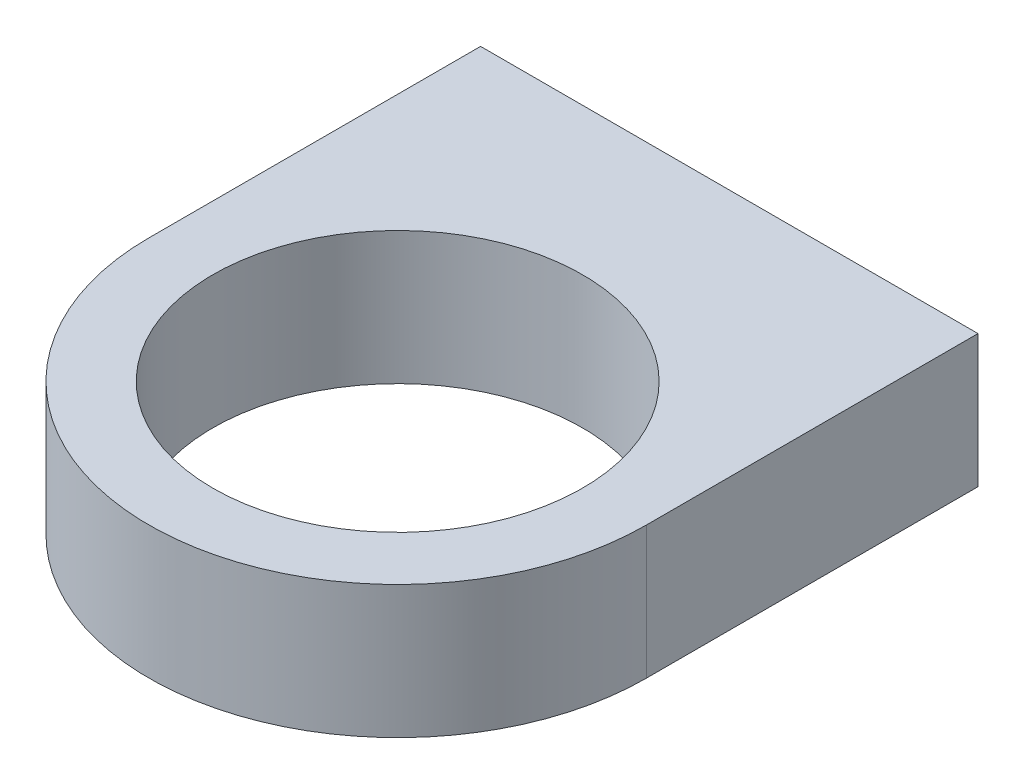
from build123d import *

# Parameters (mm, degrees)
CROQUIS1_R              = 11.15
SALIENTE_EXTRUIR1_DEPTH = 8


with BuildPart() as part:
    # Croquis1 → Saliente-Extruir1 (new body)
    with BuildSketch(Plane(origin=(0, 0, 0), x_dir=(1, 0, 0), z_dir=(0, 1, 0))):
        with BuildLine():
            Line((-15, 0), (-15, 20))
            Line((-15, 20), (15, 20))
            Line((15, 20), (15, 0))
            ThreePointArc((15, 0), (0, -15), (-15, 0))
        make_face()
        with Locations(Location((0, 0, 0), (0, 0, 270))):
            Circle(CROQUIS1_R, mode=Mode.SUBTRACT)
    extrude(amount=SALIENTE_EXTRUIR1_DEPTH)


solid = part.part
